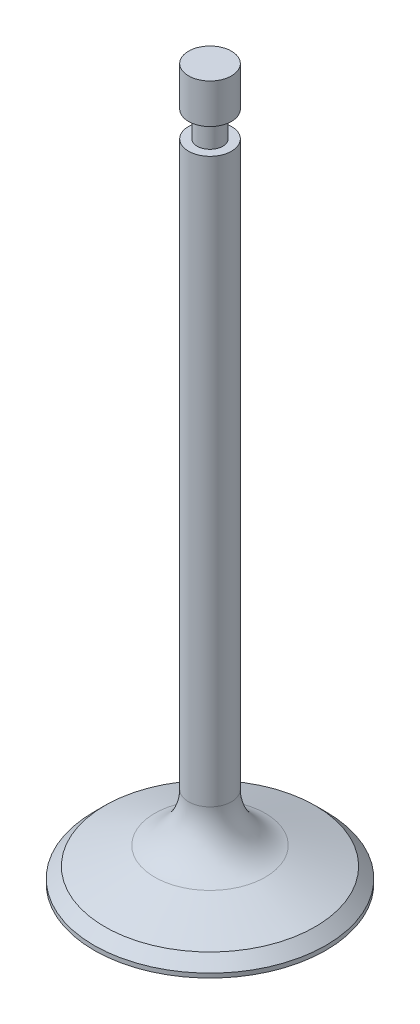
from build123d import *


with BuildPart() as part:
    # Sketch1 → Revolve1 (revolve)
    with BuildSketch(Plane.XY, mode=Mode.PRIVATE) as revolve1_sk:
        with BuildLine():
            Line((0, 0), (0, 84))
            Line((0, 84), (2.5, 84))
            Line((2.5, 84), (2.5, 79.4))
            Line((2.5, 79.4), (1.5, 79.4))
            Line((1.5, 79.4), (1.5, 76.4))
            Line((1.5, 76.4), (2.5, 76.4))
            Line((2.5, 76.4), (2.5, 10.749955013))
            ThreePointArc((2.5, 10.749955013), (3.585087734, 7.308496395), (6.44787914, 5.111799289))
            Line((6.44787914, 5.111799289), (12.25, 3))
            Line((12.25, 3), (13.5, 1.75))
            Line((13.5, 1.75), (13.5, 1.25))
            ThreePointArc((13.5, 1.25), (6.778873431, 0.31316694), (0, 0))
        make_face()
    revolve(revolve1_sk.sketch.rotate(Axis((0, 0, 0), (0, 1, 0)), 90), axis=Axis((0, 0, 0), (0, 1, 0)))


solid = part.part
